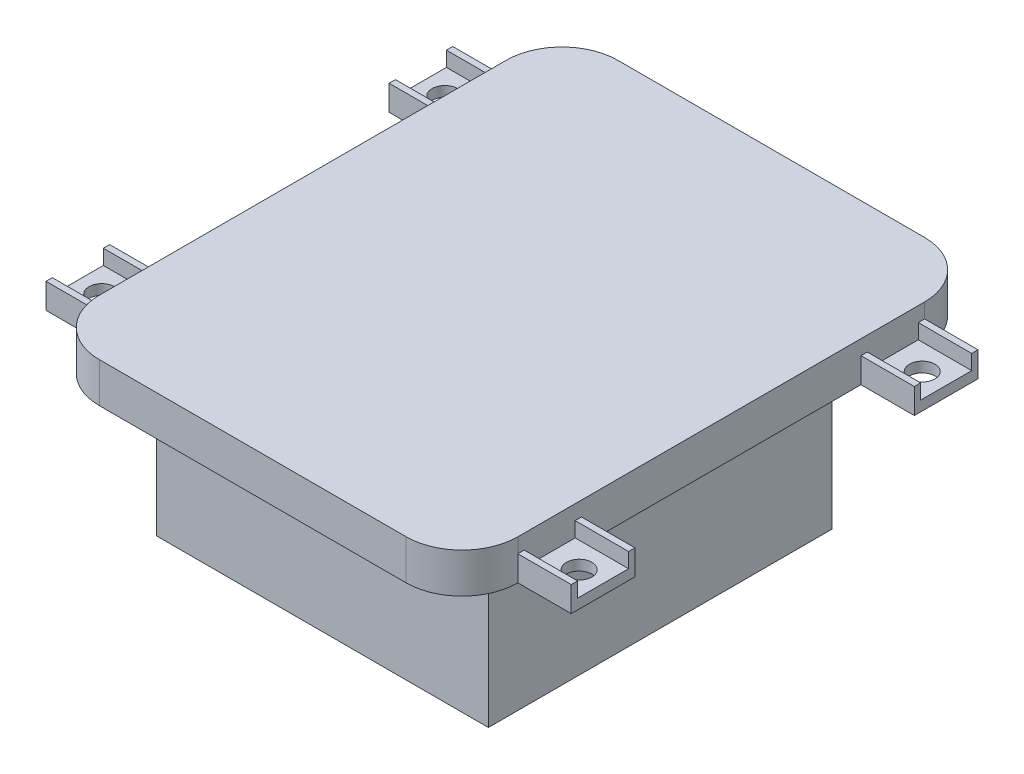
from build123d import *

# Parameters (mm, degrees)
SKETCH1_W           = 6.691688341
SKETCH1_H           = 7.98
SKETCH1_R           = 1.6
BOSS_EXTRUDE1_DEPTH = 5
SKETCH2_W           = 41.577195194
SKETCH2_H           = 43.078854614
BOSS_EXTRUDE2_DEPTH = 21.5
CUT_EXTRUDE1_DEPTH  = 6.691688
CUT_EXTRUDE2_START  = -65.83
CUT_EXTRUDE2_DEPTH  = 6.691688
RIB2_REACH          = 54.453
SKETCH4_WALL_W      = 115.956406408
SKETCH4_WALL_H      = 30


with BuildPart() as part:
    # Sketch1 → Boss-Extrude1 (new body)
    # profile 1 of 5: a face of its own
    with BuildSketch(Plane(origin=(0, 0, 0), x_dir=(1, 0, 0), z_dir=(0, 1, 0))):
        with Locations((-29.569155829, 21.5)):
            Rectangle(SKETCH1_W, SKETCH1_H)
        with Locations(Location((-29.915, 21.5, 0), (0, 0, 270))):
            Circle(SKETCH1_R, mode=Mode.SUBTRACT)
    # profile 2 of 5: a face of its own
    with BuildSketch(Plane(origin=(0, 0, 0), x_dir=(1, 0, 0), z_dir=(0, 1, 0))):
        with Locations((-29.569155829, -21.5)):
            Rectangle(SKETCH1_W, SKETCH1_H)
        with Locations(Location((-29.915, -21.5, 0), (0, 0, 270))):
            Circle(SKETCH1_R, mode=Mode.SUBTRACT)
    # profile 3 of 5: a face of its own
    with BuildSketch(Plane(origin=(0, 0, 0), x_dir=(1, 0, 0), z_dir=(0, 1, 0))):
        with BuildLine():
            Line((-26.223311659, 25.49), (-26.223311659, 17.51))
            Line((-26.223311659, 17.51), (-26.223311659, -17.51))
            Line((-26.223311659, -17.51), (-26.223311659, -25.49))
            ThreePointArc((-26.223311659, -25.49), (-24.173059128, -30.439747468), (-19.223311659, -32.49))
            Line((-19.223311659, -32.49), (19.223311659, -32.49))
            ThreePointArc((19.223311659, -32.49), (24.173059128, -30.439747468), (26.223311659, -25.49))
            Line((26.223311659, -25.49), (26.223311659, -17.51))
            Line((26.223311659, -17.51), (26.223311659, 17.51))
            Line((26.223311659, 17.51), (26.223311659, 25.49))
            ThreePointArc((26.223311659, 25.49), (24.173059128, 30.439747468), (19.223311659, 32.49))
            Line((19.223311659, 32.49), (-19.223311659, 32.49))
            ThreePointArc((-19.223311659, 32.49), (-24.173059128, 30.439747468), (-26.223311659, 25.49))
        make_face()
    # profile 4 of 5: a face of its own
    with BuildSketch(Plane(origin=(0, 0, 0), x_dir=(1, 0, 0), z_dir=(0, 1, 0))):
        with Locations((29.569155829, 21.5)):
            Rectangle(SKETCH1_W, SKETCH1_H)
        with Locations(Location((29.915, 21.5, 0), (0, 0, 270))):
            Circle(SKETCH1_R, mode=Mode.SUBTRACT)
    # profile 5 of 5: a face of its own
    with BuildSketch(Plane(origin=(0, 0, 0), x_dir=(1, 0, 0), z_dir=(0, 1, 0))):
        with Locations((29.569155829, -21.5)):
            Rectangle(SKETCH1_W, SKETCH1_H)
        with Locations(Location((29.915, -21.5, 0), (0, 0, 270))):
            Circle(SKETCH1_R, mode=Mode.SUBTRACT)
    extrude(amount=BOSS_EXTRUDE1_DEPTH)

    # Sketch2 → Boss-Extrude2 (add)
    with BuildSketch(Plane.XZ):
        with Locations((-2.205562273, 0)):
            Rectangle(SKETCH2_W, SKETCH2_H)
    extrude(amount=BOSS_EXTRUDE2_DEPTH)

    # Sketch3 → Cut-Extrude1 (cut)
    with BuildSketch(Plane.ZY.offset(32.915)):
        Polygon((-18.304058028, 3.156143774), (-17.51, 3.156143774), (-17.51, 5), (-25.49, 5), (-25.49, 3.156143774), (-24.695941972, 3.156143774), (-24.695941972, 1.28299036), (-18.304058028, 1.28299036), align=None)
        Polygon((24.695941972, 3.156143774), (25.49, 3.156143774), (25.49, 5), (17.51, 5), (17.51, 3.156143774), (18.304058028, 3.156143774), (18.304058028, 1.28299036), (24.695941972, 1.28299036), align=None)
    extrude(amount=-CUT_EXTRUDE1_DEPTH, mode=Mode.SUBTRACT)

    # Sketch3<3> → Cut-Extrude2 (cut)
    with BuildSketch(Plane.ZY.offset(32.915).offset(CUT_EXTRUDE2_START)):
        Polygon((24.695941972, 3.156143774), (25.49, 3.156143774), (25.49, 5), (17.51, 5), (17.51, 3.156143774), (18.304058028, 3.156143774), (18.304058028, 1.28299036), (24.695941972, 1.28299036), align=None)
        Polygon((-18.304058028, 3.156143774), (-17.51, 3.156143774), (-17.51, 5), (-25.49, 5), (-25.49, 3.156143774), (-24.695941972, 3.156143774), (-24.695941972, 1.28299036), (-18.304058028, 1.28299036), align=None)
    extrude(amount=CUT_EXTRUDE2_DEPTH, mode=Mode.SUBTRACT)

    # Sketch4 wall → Rib2 (add, up to next)
    with BuildSketch(Plane(origin=(-2.205562273, -2.161622642, -25.515102301), x_dir=(0, 0.477671912918, -0.878538299455), z_dir=(0, 0.878538299455, 0.477671912918)), mode=Mode.PRIVATE) as rib2_sk1:
        Rectangle(SKETCH4_WALL_W, SKETCH4_WALL_H)
    rib2_tool1 = extrude(rib2_sk1.sketch, amount=RIB2_REACH, mode=Mode.PRIVATE) - part.part
    rib2 = rib2_tool1.solids().sort_by_distance((-2.205562273, -2.161622642, -25.515102301))[0]
    add(rib2)

    # Mirror4: Rib2 across plane
    add(rib2.mirror(Plane.XY))


solid = part.part
